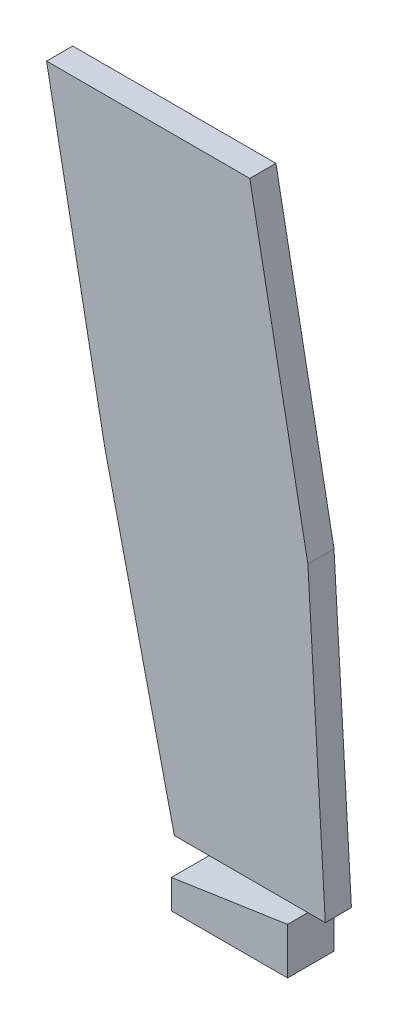
from build123d import *

# Parameters (mm, degrees)
BOSS_EXTRUDE1_DEPTH = 80
BOSS_EXTRUDE2_DEPTH = 45


with BuildPart() as part:
    # Sketch1 → Boss-Extrude1 (new body)
    with BuildSketch(Plane.XY):
        Polygon((950, 500), (950, 550), (1150, 580), (1150, 500), align=None)
    extrude(amount=BOSS_EXTRUDE1_DEPTH)


with BuildPart() as body_2:
    # Sketch2 → Boss-Extrude2 (new body)
    with BuildSketch(Plane.XY):
        Polygon((920, 580), (800, 1100), (700, 1625), (1050, 1625), (1150, 1100), (1180, 580), align=None)
    extrude(amount=BOSS_EXTRUDE2_DEPTH)


solid = Compound([part.part, body_2.part])
